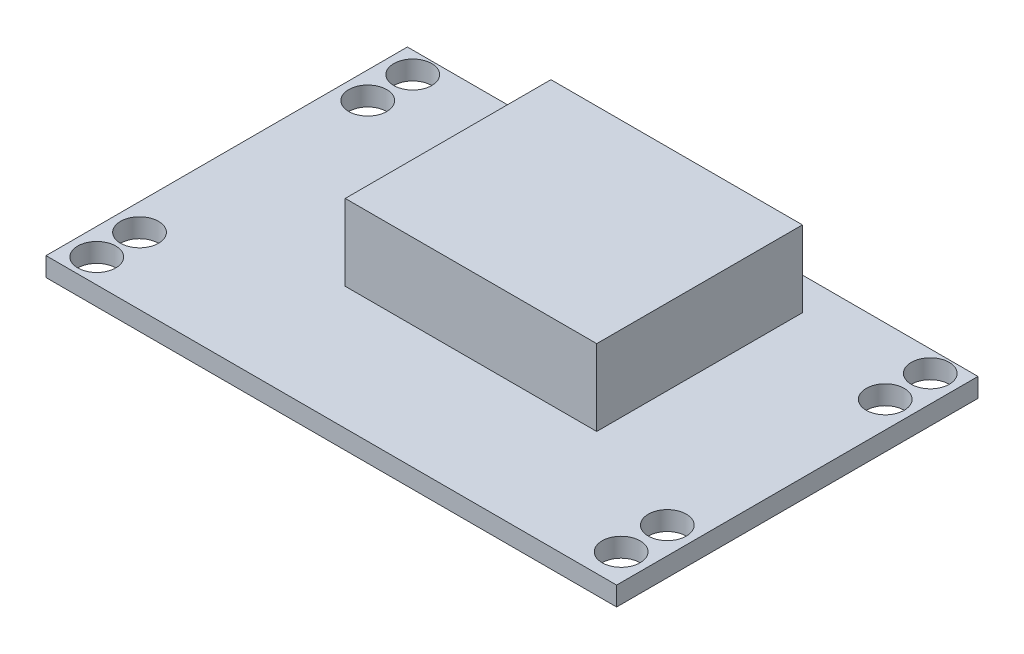
from build123d import *

# Parameters (mm, degrees)
SKETCH1_W           = 30
SKETCH1_H           = 19
BOSS_EXTRUDE1_DEPTH = 1
SKETCH2_W           = 13.222286428
SKETCH2_H           = 10.81458632
BOSS_EXTRUDE2_DEPTH = 4
SKETCH3_R           = 1
CUT_EXTRUDE1_DEPTH  = 36.73513677


with BuildPart() as part:
    # Sketch1 → Boss-Extrude1 (new body)
    with BuildSketch(Plane(origin=(0, 0, 0), x_dir=(1, 0, 0), z_dir=(0, 1, 0))):
        with Locations((15, 9.5)):
            Rectangle(SKETCH1_W, SKETCH1_H)
    extrude(amount=BOSS_EXTRUDE1_DEPTH)

    # Sketch2 → Boss-Extrude2 (add)
    with BuildSketch(Plane(origin=(0, 1, 0), x_dir=(1, 0, 0), z_dir=(0, 1, 0))):
        with Locations((15.872791289, 11.877603857)):
            Rectangle(SKETCH2_W, SKETCH2_H)
    extrude(amount=BOSS_EXTRUDE2_DEPTH)

    # Sketch3 → Cut-Extrude1 (cut, through all)
    with BuildSketch(Plane(origin=(0, 1, 0), x_dir=(1, 0, 0), z_dir=(0, 1, 0))):
        with Locations(Location((1.396494389, 17.886822044, 0), (0, 0, 270))):
            Circle(SKETCH3_R)
        with Locations(Location((1.396494389, 15.519250271, 0), (0, 0, 270))):
            Circle(SKETCH3_R)
        with Locations(Location((1.396494389, 3.520878065, 0), (0, 0, 270))):
            Circle(SKETCH3_R)
        with Locations(Location((1.396494389, 1.273691297, 0), (0, 0, 270))):
            Circle(SKETCH3_R)
        with Locations(Location((28.603505611, 1.634846313, 0), (0, 0, 270))):
            Circle(SKETCH3_R)
        with Locations(Location((28.603505611, 4.062610589, 0), (0, 0, 270))):
            Circle(SKETCH3_R)
        with Locations(Location((28.603505611, 17.886822044, 0), (0, 0, 270))):
            Circle(SKETCH3_R)
        with Locations(Location((28.603505611, 15.519250271, 0), (0, 0, 270))):
            Circle(SKETCH3_R)
    extrude(amount=-CUT_EXTRUDE1_DEPTH, mode=Mode.SUBTRACT)


solid = part.part
